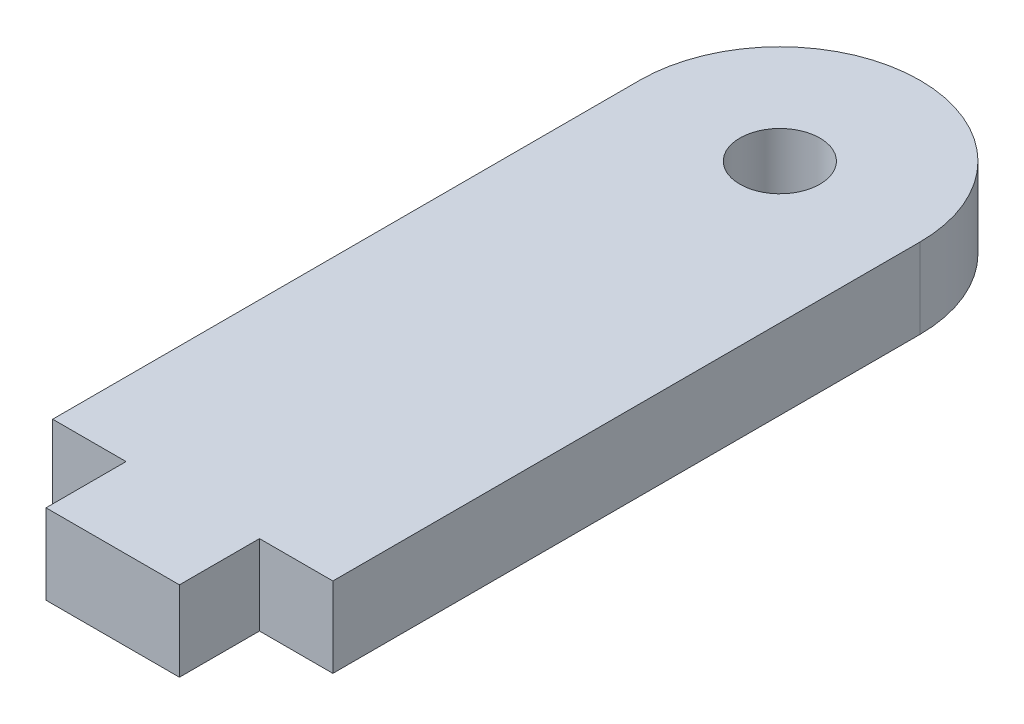
from build123d import *

# Parameters (mm, degrees)
SKETCH_1_W      = 5
SKETCH_1_H      = 3
EXTRUDE_1_DEPTH = 3


with BuildPart() as part:
    # 草图1 → 凸台-拉伸1 (new body)
    with BuildSketch(Plane(origin=(0, 0, 0), x_dir=(1, 0, 0), z_dir=(0, 1, 0))):
        with BuildLine():
            Line((10.5, -22), (10.5, 0))
            ThreePointArc((10.5, 0), (5.25, -5.25), (0, 0))
            Line((0, 0), (0, -22))
            Line((0, -22), (2.75, -22))
            Line((2.75, -22), (7.75, -22))
            Line((7.75, -22), (10.5, -22))
        make_face()
        with Locations((5.25, -23.5)):
            Rectangle(SKETCH_1_W, SKETCH_1_H)
        with BuildLine():
            ThreePointArc((3.75, 0), (5.25, 1.5), (6.75, 0))
            Line((6.75, 0), (10.5, 0))
            ThreePointArc((10.5, 0), (5.25, 5.25), (0, 0))
            Line((0, 0), (3.75, 0))
        make_face()
        with BuildLine():
            Line((10.5, 0), (6.75, 0))
            ThreePointArc((6.75, 0), (5.25, -1.5), (3.75, 0))
            Line((3.75, 0), (0, 0))
            ThreePointArc((0, 0), (5.25, -5.25), (10.5, 0))
        make_face()
    extrude(amount=EXTRUDE_1_DEPTH)


solid = part.part
